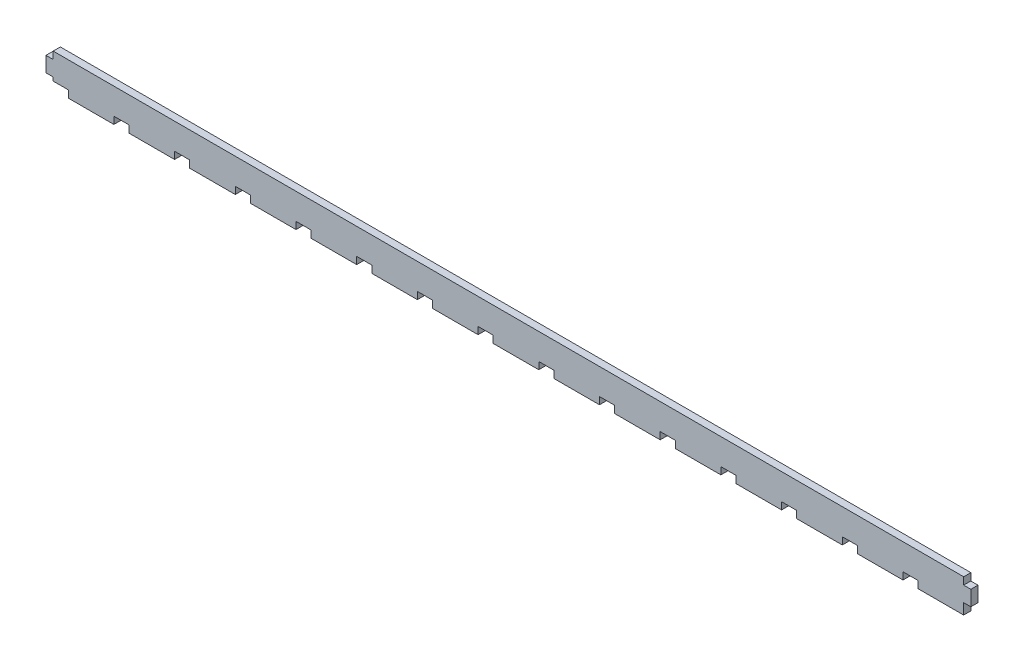
from build123d import *

# Parameters (mm, degrees)
BOSS_EXTRUDE1_DEPTH = 2.9972


with BuildPart() as part:
    # Sketch1 → Boss-Extrude1 (new body)
    with BuildSketch(Plane.XY):
        Polygon((2.9972, -15.875), (0, -15.875), (0, -9.525), (2.9972, -9.525), (2.9972, -6.477), (383.9972, -6.477), (383.9972, -9.525), (386.9944, -9.525), (386.9944, -15.875), (383.9972, -15.875), (383.9972, -17.3728), (383.9972, -20.37), (364.9472, -20.37), (364.9472, -17.3728), (358.5972, -17.3728), (358.5972, -20.37), (339.5472, -20.37), (339.5472, -17.3728), (333.1972, -17.3728), (333.1972, -20.37), (314.1472, -20.37), (314.1472, -17.3728), (307.7972, -17.3728), (307.7972, -20.37), (288.7472, -20.37), (288.7472, -17.3728), (282.3972, -17.3728), (282.3972, -20.37), (263.3472, -20.37), (263.3472, -17.3728), (256.9972, -17.3728), (256.9972, -20.37), (237.9472, -20.37), (237.9472, -17.3728), (231.5972, -17.3728), (231.5972, -20.37), (212.5472, -20.37), (212.5472, -17.3728), (206.1972, -17.3728), (206.1972, -20.37), (187.1472, -20.37), (187.1472, -17.3728), (180.7972, -17.3728), (180.7972, -20.37), (161.7472, -20.37), (161.7472, -17.3728), (155.3972, -17.3728), (155.3972, -20.37), (136.3472, -20.37), (136.3472, -17.3728), (129.9972, -17.3728), (129.9972, -20.37), (110.9472, -20.37), (110.9472, -17.3728), (104.5972, -17.3728), (104.5972, -20.37), (85.5472, -20.37), (85.5472, -17.3728), (79.1972, -17.3728), (79.1972, -20.37), (60.1472, -20.37), (60.1472, -17.3728), (53.7972, -17.3728), (53.7972, -20.37), (34.7472, -20.37), (34.7472, -17.3728), (28.3972, -17.3728), (28.3972, -20.37), (9.3472, -20.37), (9.3472, -17.3728), (2.9972, -17.3728), align=None)
    extrude(amount=BOSS_EXTRUDE1_DEPTH)


solid = part.part
